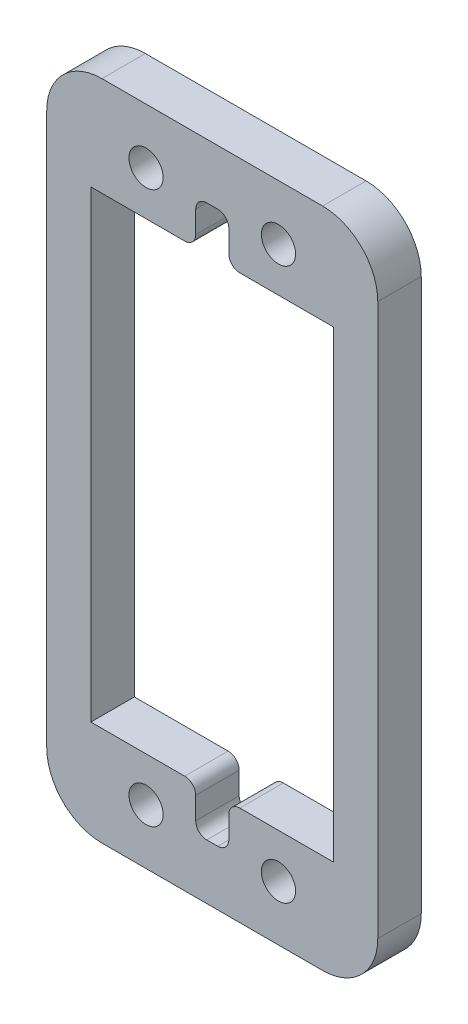
from build123d import *

# Parameters (mm, degrees)
CROQUIS1_W              = 30
CROQUIS1_H              = 60
SALIENTE_EXTRUIR1_DEPTH = 3.94
CROQUIS2_W              = 22
CROQUIS2_H              = 42
CORTAR_EXTRUIR1_DEPTH   = 34.771638989
CROQUIS3_R              = 1.55
CORTAR_EXTRUIR2_DEPTH   = 34.771638989
REDONDEO1_R             = 5
REDONDEO3_R             = 1


with BuildPart() as part:
    # Croquis1 → Saliente-Extruir1 (new body)
    with BuildSketch(Plane.XY):
        Rectangle(CROQUIS1_W, CROQUIS1_H)
    extrude(amount=SALIENTE_EXTRUIR1_DEPTH)

    # Croquis2 → Cortar-Extruir1 (cut, through all)
    with BuildSketch(Plane(origin=(0, 0, 0), x_dir=(-1, 0, 0), z_dir=(0, 0, -1))):
        Rectangle(CROQUIS2_W, CROQUIS2_H)
    extrude(amount=-CORTAR_EXTRUIR1_DEPTH, mode=Mode.SUBTRACT)

    # Croquis3 → Cortar-Extruir2 (cut, through all)
    with BuildSketch(Plane(origin=(0, 0, 0), x_dir=(-1, 0, 0), z_dir=(0, 0, -1))):
        with Locations((-6, 25)):
            Circle(CROQUIS3_R)
        with Locations((6, 25)):
            Circle(CROQUIS3_R)
        with Locations((-6, -25)):
            Circle(CROQUIS3_R)
        with Locations((6, -25)):
            Circle(CROQUIS3_R)
        Polygon((-1.5, 21), (-1.5, 25), (1.5, 25), (1.5, -25), (-1.5, -25), align=None)
    extrude(amount=-CORTAR_EXTRUIR2_DEPTH, mode=Mode.SUBTRACT)

    # Redondeo1
    redondeo1_edges = [part.edges().sort_by_distance(p)[0] for p in [
        (-15, 30, 1.97),
        (15, 30, 1.97),
        (15, -30, 1.97),
        (-15, -30, 1.97),
    ]]
    fillet(redondeo1_edges, radius=REDONDEO1_R)

    # Redondeo3
    redondeo3_edges = [part.edges().sort_by_distance(p)[0] for p in [
        (1.5, -21, 1.97),
        (-1.5, -21, 1.97),
        (-1.5, 21, 1.97),
        (-1.5, 25, 1.97),
        (1.5, 21, 1.97),
        (1.5, -25, 1.97),
        (-1.5, -25, 1.97),
        (1.5, 25, 1.97),
    ]]
    fillet(redondeo3_edges, radius=REDONDEO3_R)


solid = part.part
